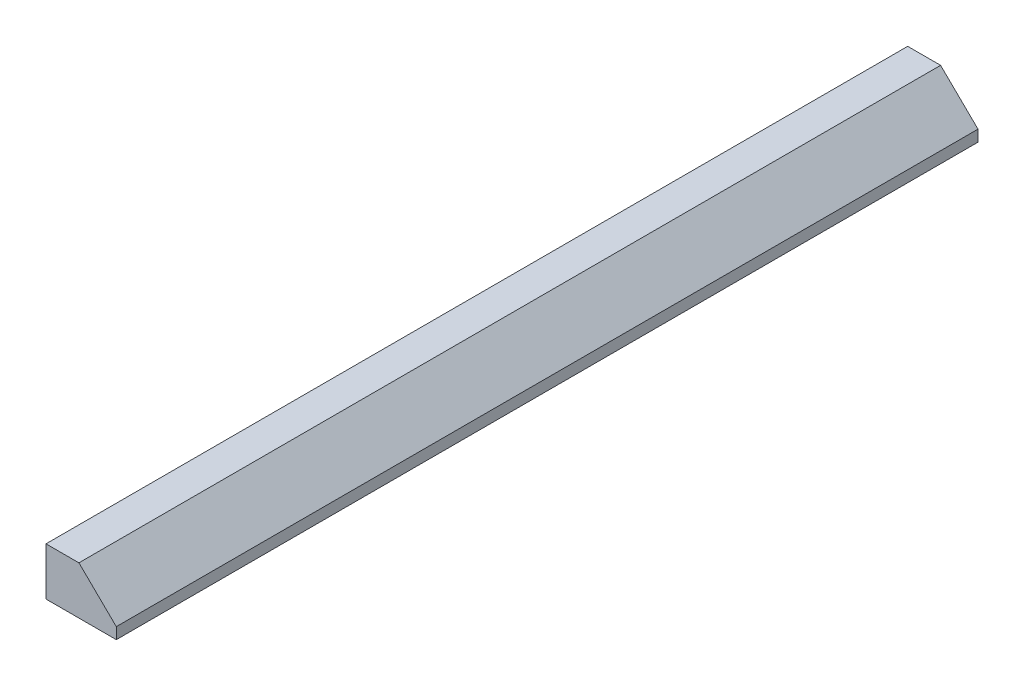
from build123d import *

# Parameters (mm, degrees)
BOSS_EXTRUDE1_DEPTH = 1828.8
SKETCH3_R           = 8.5725
CUT_EXTRUDE2_DEPTH  = 63.5


with BuildPart() as part:
    # Sketch1 → Boss-Extrude1 (new body)
    with BuildSketch(Plane.XY):
        Polygon((4.233333333, 36.865277778), (83.608333333, -40.745833333), (83.608333333, -64.734722222), (-65.616666667, -64.734722222), (-65.616666667, 36.865277778), align=None)
    extrude(amount=BOSS_EXTRUDE1_DEPTH)

    # Sketch3 → Cut-Extrude2 (cut)
    with BuildSketch(Plane.ZY.offset(65.616666667)):
        with Locations((769.62, -13.934722222)):
            Circle(SKETCH3_R)
        with Locations(Location((1059.18, -13.934722222, 0), (0, 0, 180))):
            Circle(SKETCH3_R)
    extrude(amount=-CUT_EXTRUDE2_DEPTH, mode=Mode.SUBTRACT)


solid = part.part
